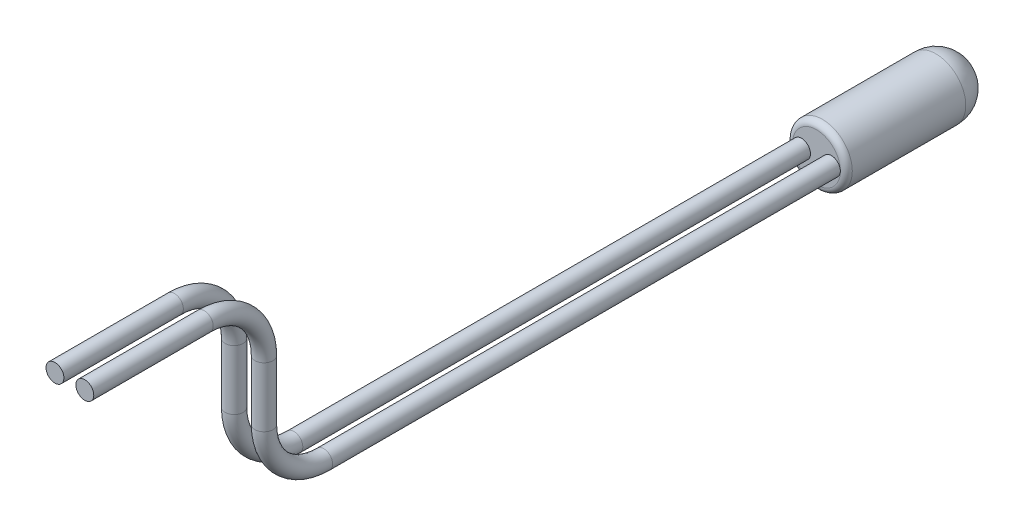
from build123d import *

# Parameters (mm, degrees)
FILLET2_R = 0.1
SKETCH3_R = 0.15


with BuildPart() as part:
    # Sketch2 → Revolve1 (revolve)
    with BuildSketch(Plane(origin=(0, 0, 0), x_dir=(1, 0, 0), z_dir=(0, 1, 0))):
        with BuildLine():
            Line((0, 1.25), (0, -1.25))
            Line((0, -1.25), (-0.5, -1.25))
            Line((-0.5, -1.25), (-0.5, 0.75))
            ThreePointArc((-0.5, 0.75), (-0.353553391, 1.103553391), (0, 1.25))
        make_face()
    revolve(axis=Axis((0, 0, -1.25), (0, 0, 1)))

    # Fillet2
    fillet2_edges = [part.edges().sort_by_distance(p)[0] for p in [
        (0.5, 0, 1.25),
    ]]
    fillet(fillet2_edges, radius=FILLET2_R)


with BuildPart() as body_2:
    # Sweep1: sweep along a path in Sketch4
    with BuildLine(Plane(origin=(0, 0, 0), x_dir=(0, 0, -1), z_dir=(1, 0, 0))) as sweep1_path:
        Line((-1.25, 0), (-9.75, 0))
        ThreePointArc((-9.75, 0), (-10.457106781, 0.292893219), (-10.75, 1))
        Line((-10.75, 1), (-10.75, 2))
        ThreePointArc((-10.75, 2), (-11.042893219, 2.707106781), (-11.75, 3))
        Line((-11.75, 3), (-13.75, 3))
    # Sketch3 → Sweep1 (sweep)
    with BuildSketch(Plane.XY.offset(1.25)):
        with Locations((-0.25, 0)):
            Circle(SKETCH3_R)
        with Locations((0.25, 0)):
            Circle(SKETCH3_R)
    sweep(path=sweep1_path.line)


solid = Compound([part.part, body_2.part])
